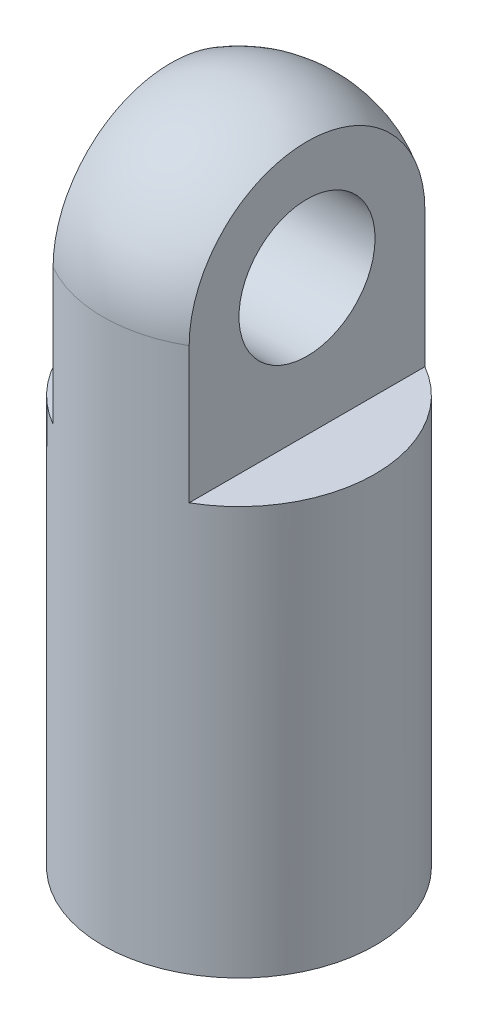
from build123d import *

# Parameters (mm, degrees)
SKETCH_1_R          = 8
EXTRUDE_1_DEPTH     = 32
CUT_EXTRUDE_START   = -16
CUT_EXTRUDE_1_DEPTH = 16
SKETCH_6_R          = 4
CUT_EXTRUDE_2_DEPTH = 43.520583251


with BuildPart() as part:
    # 草图1 → 凸台-拉伸1 (new body)
    with BuildSketch(Plane(origin=(0, 0, 0), x_dir=(1, 0, 0), z_dir=(0, 1, 0))):
        with Locations(Location((0, 0, 0), (0, 0, 270))):
            Circle(SKETCH_1_R)
    extrude(amount=EXTRUDE_1_DEPTH)

    # 草图3 one side → 旋转4 (revolve)
    with BuildSketch(Plane.XY):
        with BuildLine():
            Line((0, 24), (0, 40))
            ThreePointArc((0, 40), (-8, 32), (0, 24))
        make_face()
    revolve(axis=Axis((0, 32, 0), (0, 1, 0)))

    # 草图5 → 切除-拉伸1 (cut)
    with BuildSketch(Plane(origin=(0, 40, 0), x_dir=(1, 0, 0), z_dir=(0, 1, 0)).offset(CUT_EXTRUDE_START)):
        with BuildLine():
            Line((4, -6.92820323), (4, 6.92820323))
            ThreePointArc((4, 6.92820323), (8, 0), (4, -6.92820323))
        make_face()
        with BuildLine():
            Line((-4, -6.92820323), (-4, 6.92820323))
            ThreePointArc((-4, 6.92820323), (-8, 0), (-4, -6.92820323))
        make_face()
    extrude(amount=CUT_EXTRUDE_1_DEPTH, mode=Mode.SUBTRACT)

    # 草图6 → 切除-拉伸2 (cut, through all)
    with BuildSketch(Plane(origin=(4, 0, 0), x_dir=(0, 0, -1), z_dir=(1, 0, 0))):
        with Locations((0, 32)):
            Circle(SKETCH_6_R)
    extrude(amount=-CUT_EXTRUDE_2_DEPTH, mode=Mode.SUBTRACT)


solid = part.part
